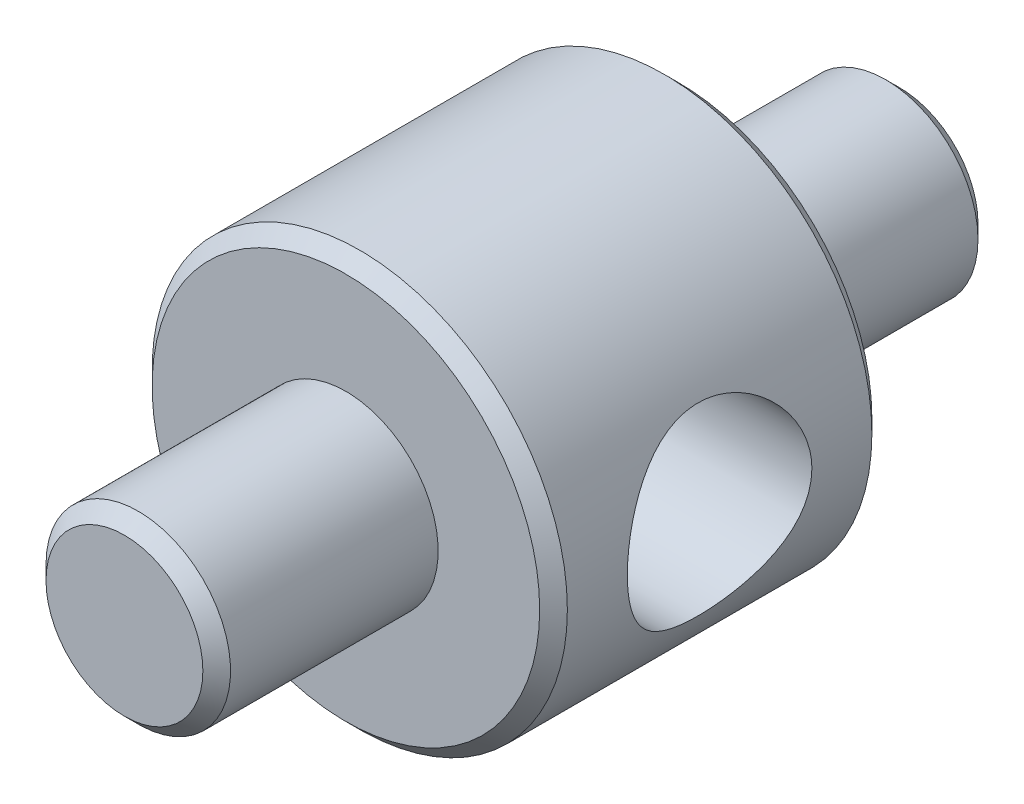
from build123d import *

# Parameters (mm, degrees)
SKETCH1_R               = 22.5
BOSS_EXTRUDE1_DEPTH     = 18
SKETCH1_3_R             = 10
BOSS_EXTRUDE2_DEPTH     = 42
CUT_EXTRUDE1_DEPTH      = 53.692504211
CUT_EXTRUDE1_DEPTH_BACK = 53.692504211
SKETCH2_R               = 10
CHAMFER1_SIZE           = 1.5


with BuildPart() as part:
    # Sketch1 → Boss-Extrude1 (new, symmetric)
    with BuildSketch(Plane.XY):
        Circle(SKETCH1_R)
    extrude(amount=BOSS_EXTRUDE1_DEPTH, both=True)

    # Sketch1<3> → Boss-Extrude2 (add, symmetric)
    with BuildSketch(Plane.XY):
        Circle(SKETCH1_3_R)
    extrude(amount=BOSS_EXTRUDE2_DEPTH, both=True)

    # Sketch2 → Cut-Extrude1 (cut, two sides: drawn at the far end of the back side and taken through both)
    with BuildSketch(Plane(origin=(0, 0, 0), x_dir=(0, 0, -1), z_dir=(1, 0, 0)).offset(-CUT_EXTRUDE1_DEPTH_BACK)):
        Circle(SKETCH2_R)
    extrude(amount=CUT_EXTRUDE1_DEPTH + CUT_EXTRUDE1_DEPTH_BACK, mode=Mode.SUBTRACT)

    # Chamfer1
    chamfer1_edges = [part.edges().sort_by_distance(p)[0] for p in [
        (-10, 0, 42),
        (-10, 0, -42),
        (-22.5, 0, -18),
        (-22.5, 0, 18),
    ]]
    chamfer(chamfer1_edges, length=CHAMFER1_SIZE)


solid = part.part
